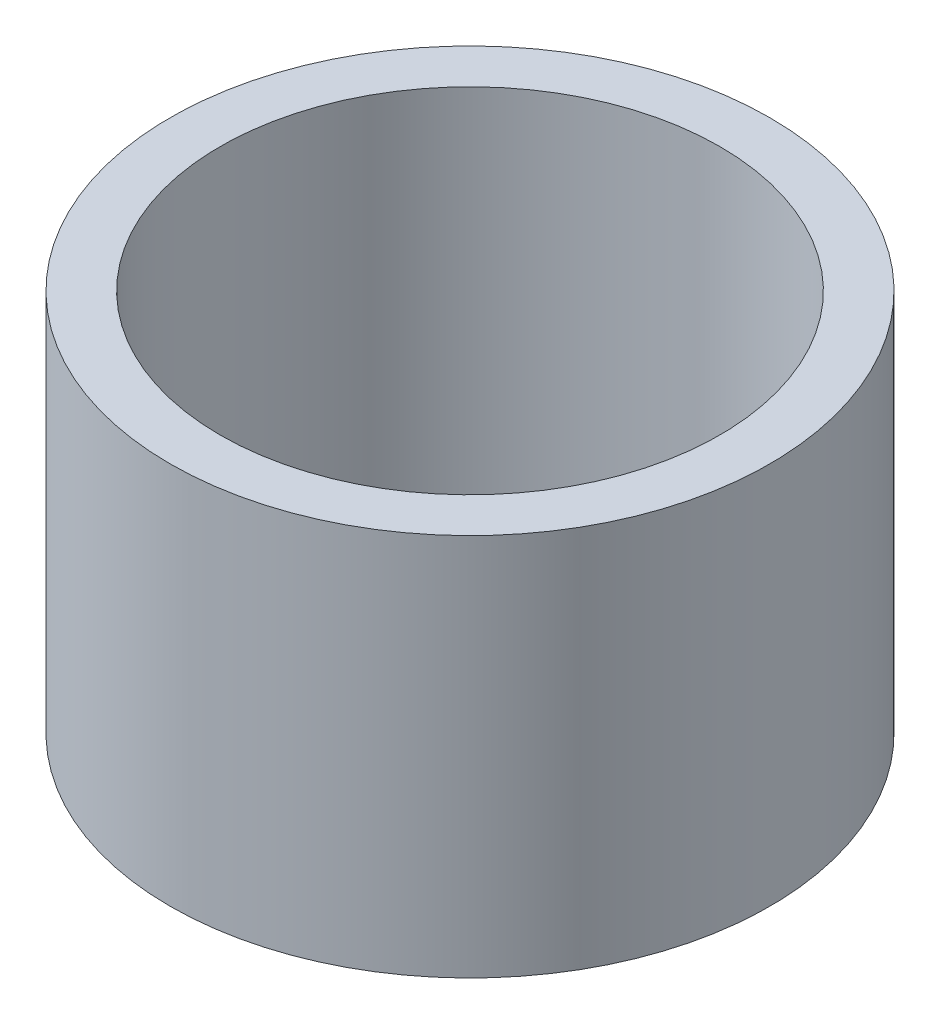
from build123d import *

# Parameters (mm, degrees)
SKETCH1_R           = 18
SKETCH1_R_2         = 15
BOSS_EXTRUDE1_DEPTH = 23


with BuildPart() as part:
    # Sketch1 → Boss-Extrude1 (new body)
    with BuildSketch(Plane(origin=(0, 0, 0), x_dir=(1, 0, 0), z_dir=(0, 1, 0))):
        with Locations(Location((0, 0, 0), (0, 0, 270))):
            Circle(SKETCH1_R)
        with Locations(Location((0, 0, 0), (0, 0, 270))):
            Circle(SKETCH1_R_2, mode=Mode.SUBTRACT)
    extrude(amount=BOSS_EXTRUDE1_DEPTH)


solid = part.part
